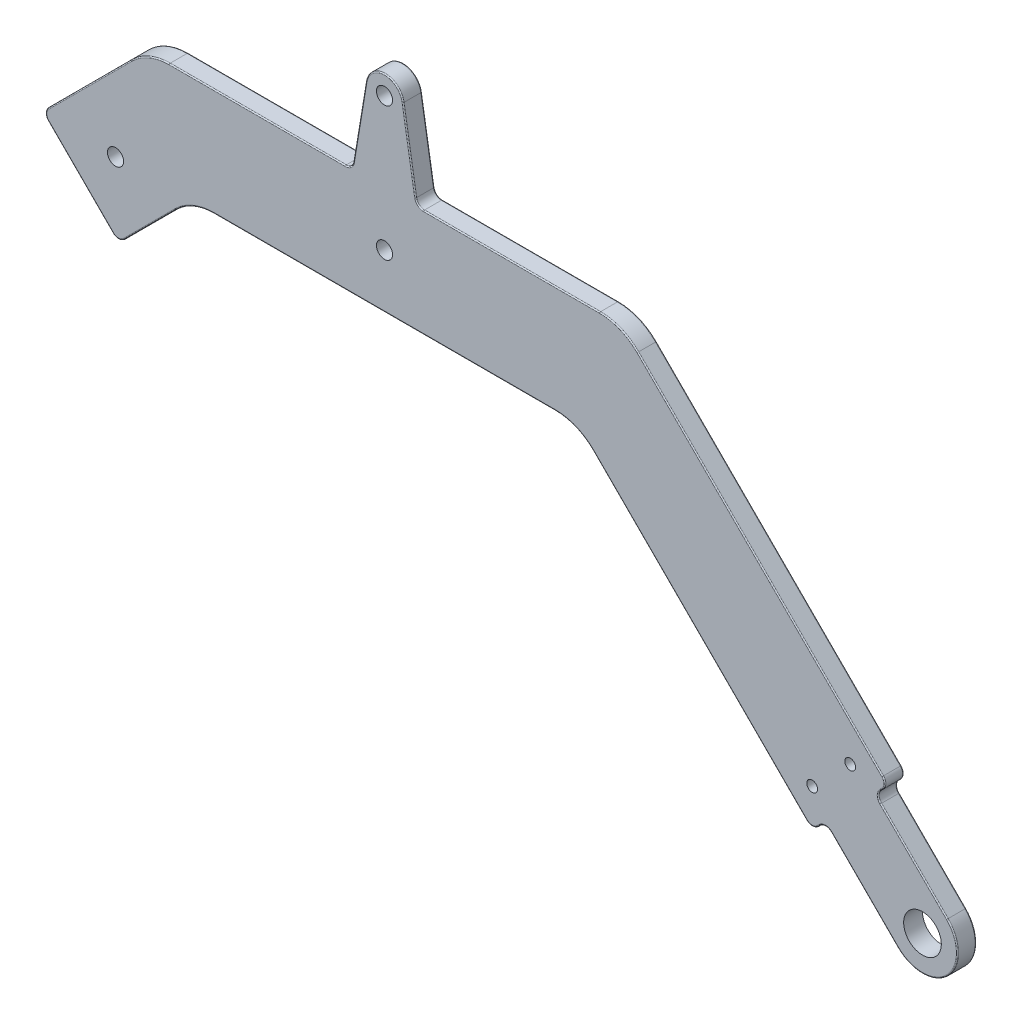
from build123d import *

# Parameters (mm, degrees)
SKETCH5_R           = 3.5
SKETCH5_R_2         = 1.5
SKETCH5_R_3         = 1
BOSS_EXTRUDE1_DEPTH = 3.5
FILLET1_R           = 10
FILLET2_R           = 1.5
FILLET3_R           = 0.2


with BuildPart() as part:
    # Sketch5 → Boss-Extrude1 (new body)
    with BuildSketch(Plane.XY):
        with BuildLine():
            Line((91.161165235, 18.03122292), (104.596194078, 4.596194078))
            ThreePointArc((104.596194078, 4.596194078), (104.596194078, -4.596194078), (95.403805922, -4.596194078))
            Line((95.403805922, -4.596194078), (81.96877708, 8.838834765))
            Line((81.96877708, 8.838834765), (79.493903346, 6.363961031))
            Line((79.493903346, 6.363961031), (35.857864376, 50))
            Line((35.857864376, 50), (-35.857864376, 50))
            Line((-35.857864376, 50), (-49.445436483, 36.412427894))
            Line((-49.445436483, 36.412427894), (-63.587572106, 50.554563517))
            Line((-63.587572106, 50.554563517), (-44.142135624, 70))
            Line((-44.142135624, 70), (-6, 70))
            Line((-6, 70), (-3.453220204, 85.420324662))
            ThreePointArc((-3.453220204, 85.420324662), (0, 88.35), (3.453220204, 85.420324662))
            Line((3.453220204, 85.420324662), (6, 70))
            Line((6, 70), (44.142135624, 70))
            Line((44.142135624, 70), (93.636038969, 20.506096654))
            Line((93.636038969, 20.506096654), (91.161165235, 18.03122292))
        make_face()
        with Locations((100, 0)):
            Circle(SKETCH5_R, mode=Mode.SUBTRACT)
        with Locations((0, 84.85)):
            Circle(SKETCH5_R_2, mode=Mode.SUBTRACT)
        with Locations((0, 60)):
            Circle(SKETCH5_R_2, mode=Mode.SUBTRACT)
        with Locations((86.564971157, 20.506096654)):
            Circle(SKETCH5_R_3, mode=Mode.SUBTRACT)
        with Locations((79.493903346, 13.435028843)):
            Circle(SKETCH5_R_3, mode=Mode.SUBTRACT)
        with Locations((-50, 50)):
            Circle(SKETCH5_R_2, mode=Mode.SUBTRACT)
    extrude(amount=BOSS_EXTRUDE1_DEPTH)

    # Fillet1
    fillet1_edges = [part.edges().sort_by_distance(p)[0] for p in [
        (44.142135624, 70, 1.75),
        (35.857864376, 50, 1.75),
        (-35.857864376, 50, 1.75),
        (-44.142135624, 70, 1.75),
    ]]
    fillet(fillet1_edges, radius=FILLET1_R)

    # Fillet2
    fillet2_edges = [part.edges().sort_by_distance(p)[0] for p in [
        (93.636038969, 20.506096654, 1.75),
        (91.161165235, 18.03122292, 1.75),
        (81.96877708, 8.838834765, 1.75),
        (79.493903346, 6.363961031, 1.75),
        (-49.445436483, 36.412427894, 1.75),
        (-63.587572106, 50.554563517, 1.75),
        (-6, 70, 1.75),
        (6, 70, 1.75),
    ]]
    fillet(fillet2_edges, radius=FILLET2_R)

    # Fillet3
    fillet3_edges = [part.edges().sort_by_distance(p)[0] for p in [
        (89.216621587, 1.590990258, 3.5),
        (80.731340213, 7.601397898, 0),
        (80.731340213, 7.601397898, 3.5),
        (-23.636292033, 70, 0),
        (4.622926377, 78.337949903, 0),
        (69.823223305, 44.318912319, 0),
        (92.398602102, 19.268659787, 0),
        (-43.585786438, 42.272077939, 0),
        (-56.516504294, 43.483495706, 0),
        (-62.966251763, 50.554563517, 0),
        (-49.445436483, 37.033748237, 0),
        (93.014718626, 20.506096654, 0),
        (79.493903346, 6.985281374, 0),
        (-23.636292033, 70, 3.5),
        (-56.516504294, 43.483495706, 3.5),
        (-43.585786438, 42.272077939, 3.5),
        (92.398602102, 19.268659787, 3.5),
        (69.823223305, 44.318912319, 3.5),
        (4.622926377, 78.337949903, 3.5),
        (-62.966251763, 50.554563517, 3.5),
        (-49.445436483, 37.033748237, 3.5),
        (93.014718626, 20.506096654, 3.5),
        (79.493903346, 6.985281374, 3.5),
        (81.96877708, 8.217514421, 0),
        (81.96877708, 8.217514421, 3.5),
        (91.782485579, 18.03122292, 0),
        (91.782485579, 18.03122292, 3.5),
        (6.302181387, 70.356182427, 0),
        (6.302181387, 70.356182427, 3.5),
        (-6.302181387, 70.356182427, 0),
        (-6.302181387, 70.356182427, 3.5),
        (0, 88.35, 3.5),
        (98.409009742, 10.783378413, 0),
        (-4.622926377, 78.337949903, 3.5),
        (104.596194078, -4.596194078, 0),
        (-4.622926377, 78.337949903, 0),
        (0, 88.35, 0),
        (104.596194078, -4.596194078, 3.5),
        (98.409009742, 10.783378413, 3.5),
        (58.610019869, 27.247844507, 0),
        (58.610019869, 27.247844507, 3.5),
        (0, 50, 0),
        (0, 50, 3.5),
        (-54.798989873, 59.343145751, 0),
        (-54.798989873, 59.343145751, 3.5),
        (23.636292033, 70, 0),
        (43.826834324, 69.238795325, 0),
        (-43.826834324, 69.238795325, 0),
        (23.636292033, 70, 3.5),
        (43.826834324, 69.238795325, 3.5),
        (-43.826834324, 69.238795325, 3.5),
        (35.542563076, 49.238795325, 0),
        (35.542563076, 49.238795325, 3.5),
        (-35.542563076, 49.238795325, 0),
        (-35.542563076, 49.238795325, 3.5),
        (89.216621587, 1.590990258, 0),
    ]]
    fillet(fillet3_edges, radius=FILLET3_R)


solid = part.part
